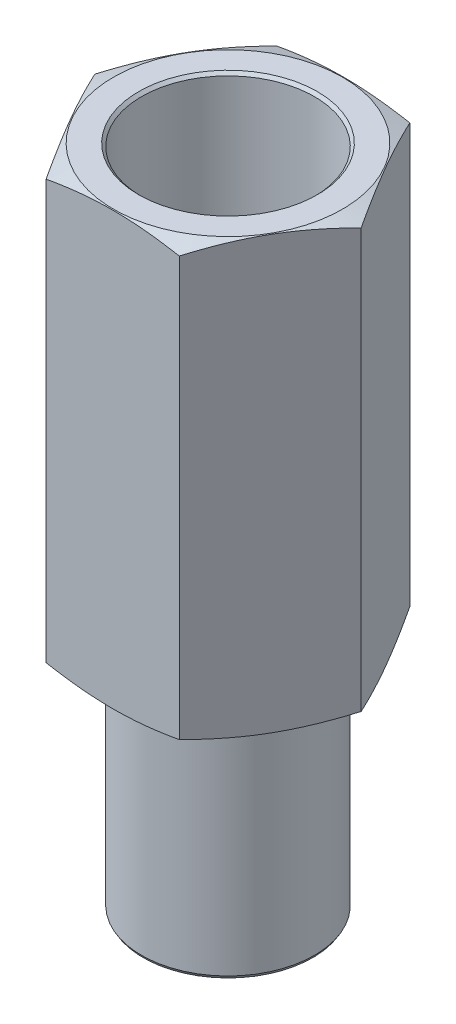
from build123d import *

# Parameters (mm, degrees)
EXTRUDE_1_DEPTH     = 15
SKETCH_2_R          = 3
EXTRUDE_2_DEPTH     = 8
SKETCH_3_R          = 3
CUT_EXTRUDE_1_DEPTH = 14
CHAMFER_1_SIZE      = 0.1
CHAMFER_1_SIZE2     = 0.057735027
CHAMFER_2_SIZE      = 0.1


with BuildPart() as part:
    # 草图1 → 凸台-拉伸1 (new body)
    with BuildSketch(Plane(origin=(0, 0, 0), x_dir=(1, 0, 0), z_dir=(0, 1, 0))):
        Polygon((2.309401077, 4), (-2.309401077, 4), (-4.618802154, 0), (-2.309401077, -4), (2.309401077, -4), (4.618802154, 0), align=None)
    extrude(amount=EXTRUDE_1_DEPTH)

    # 草图2 → 凸台-拉伸2 (add)
    with BuildSketch(Plane.XZ):
        with Locations(Location((0, 0, 0), (0, 0, 270))):
            Circle(SKETCH_2_R)
    extrude(amount=EXTRUDE_2_DEPTH)

    # 草图3 → 切除-拉伸1 (cut)
    with BuildSketch(Plane(origin=(0, 15, 0), x_dir=(1, 0, 0), z_dir=(0, 1, 0))):
        with Locations(Location((0, 0, 0), (0, 0, 90))):
            Circle(SKETCH_3_R)
    extrude(amount=-CUT_EXTRUDE_1_DEPTH, mode=Mode.SUBTRACT)

    # 草图4 → 切除-旋转1 (revolve, cut)
    with BuildSketch(Plane.XY, mode=Mode.PRIVATE) as cut_revolve_1_sk:
        Polygon((-4.618802154, 0.235852712), (-4.618802154, 0), (-3.970802154, 0), align=None)
        Polygon((-4.618802154, 15), (-4.618802154, 14.764147288), (-3.970802154, 15), align=None)
    revolve(cut_revolve_1_sk.sketch.rotate(Axis((0, -9.15, 0), (0, 1, 0)), 60.000004036), axis=Axis((0, -9.15, 0), (0, 1, 0)), mode=Mode.SUBTRACT)

    # 倒角1
    chamfer_1_edges = [part.edges().sort_by_distance(p)[0] for p in [
        (0, -8, 3),
    ]]
    chamfer_1_side = [part.faces().sort_by_distance(p)[0] for p in [
        (0, -4, 3),
    ]]
    chamfer(chamfer_1_edges, length=CHAMFER_1_SIZE, length2=CHAMFER_1_SIZE2, reference=chamfer_1_side[0])

    # 倒角2
    chamfer_2_edges = [part.edges().sort_by_distance(p)[0] for p in [
        (0, 15, 3),
    ]]
    chamfer(chamfer_2_edges, length=CHAMFER_2_SIZE)


solid = part.part
